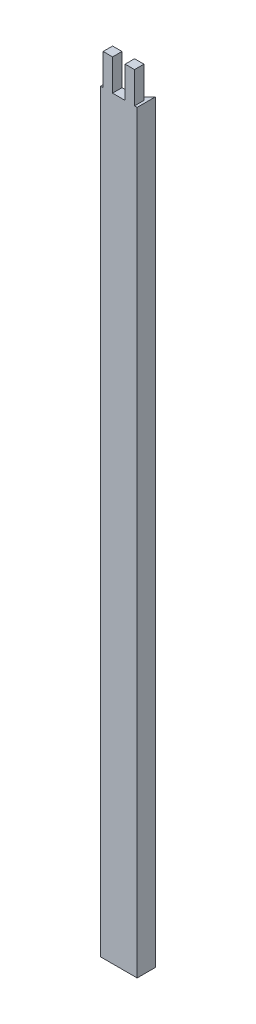
from build123d import *

# Parameters (mm, degrees)
SKETCH2_W           = 6
SKETCH2_H           = 240
BOSS_EXTRUDE1_DEPTH = 3
BOSS_EXTRUDE2_DEPTH = 240
SKETCH5_W           = 3
SKETCH5_H           = 3
BOSS_EXTRUDE3_DEPTH = 10


with BuildPart() as part:
    # Sketch2 → Boss-Extrude1 (new body)
    with BuildSketch(Plane.XY):
        with Locations((-3, -120)):
            Rectangle(SKETCH2_W, SKETCH2_H)
    extrude(amount=BOSS_EXTRUDE1_DEPTH)

    # Sketch4 → Boss-Extrude2 (add)
    with BuildSketch(Plane(origin=(0, -240, 0), x_dir=(-1, 0, 0), z_dir=(0, -1, 0))):
        Polygon((0, 0), (-2.828427125, 2.828427125), (-2.828427125, -3), (0, -3), align=None)
        Polygon((8.828427125, -3), (6, -3), (6, 0), (8.828427125, 2.828427125), align=None)
    extrude(amount=-BOSS_EXTRUDE2_DEPTH)

    # Sketch5 → Boss-Extrude3 (add)
    with BuildSketch(Plane(origin=(0, 0, 0), x_dir=(1, 0, 0), z_dir=(0, 1, 0))):
        with Locations((-6.5, -1.5)):
            Rectangle(SKETCH5_W, SKETCH5_H)
        with Locations((0.5, -1.5)):
            Rectangle(SKETCH5_W, SKETCH5_H)
    extrude(amount=BOSS_EXTRUDE3_DEPTH)


solid = part.part
